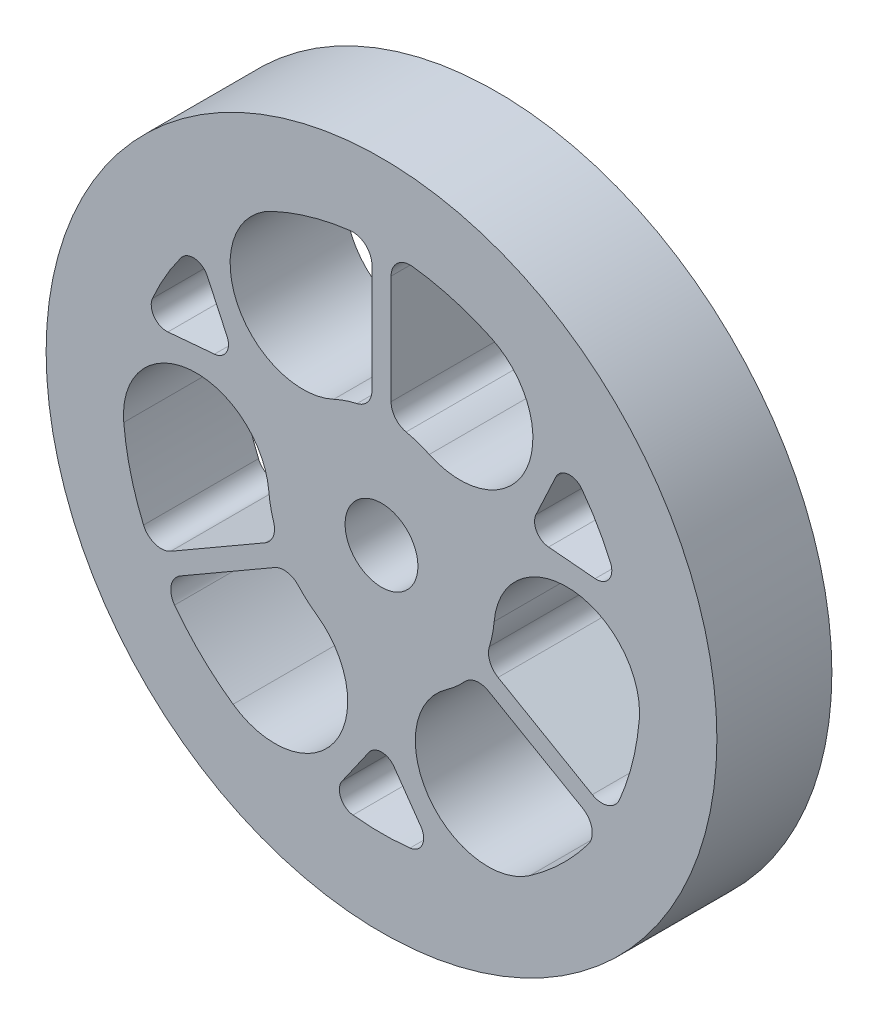
from build123d import *

# Parameters (mm, degrees)
SKETCH1_R           = 22.225
BOSS_EXTRUDE1_DEPTH = 7.62
SKETCH2_R           = 2.413
CUT_EXTRUDE1_DEPTH  = 33.341392209
EXTRUDE_THIN1_DEPTH = 7.62
FILLET1_R           = 1.27


with BuildPart() as part:
    # Sketch1 → Boss-Extrude1 (new body)
    with BuildSketch(Plane.XY):
        with Locations(Location((0, 0, 0), (0, 0, 180))):
            Circle(SKETCH1_R)
    extrude(amount=BOSS_EXTRUDE1_DEPTH)

    # Sketch2 → Cut-Extrude1 (cut, through all)
    with BuildSketch(Plane.XY.offset(7.62)):
        Circle(SKETCH2_R)
        with BuildLine():
            Line((11.546285712, 9.679232711), (10.236925711, 6.871301126))
            ThreePointArc((10.236925711, 6.871301126), (10.277852612, 5.933920972), (11.069184188, 5.429787159))
            Line((11.069184188, 5.429787159), (14.155604273, 5.159760391))
            ThreePointArc((14.155604273, 5.159760391), (15.068334078, 5.577769607), (15.176404699, 6.575831801))
            ThreePointArc((15.176404699, 6.575831801), (14.323882769, 8.269897573), (13.28303974, 9.855236107))
            ThreePointArc((13.28303974, 9.855236107), (12.364657215, 10.260675301), (11.546285712, 9.679232711))
        make_face()
        with BuildLine():
            Line((2.609318561, -14.838993102), (0.832258477, -12.301088285))
            ThreePointArc((0.832258477, -12.301088285), (0, -11.867841944), (-0.832258477, -12.301088285))
            Line((-0.832258477, -12.301088285), (-2.609318561, -14.838993102))
            ThreePointArc((-2.609318561, -14.838993102), (-2.703676863, -15.838444908), (-1.893364959, -16.431067908))
            ThreePointArc((-1.893364959, -16.431067908), (0, -16.539795145), (1.893364959, -16.431067908))
            ThreePointArc((1.893364959, -16.431067908), (2.703676863, -15.838444908), (2.609318561, -14.838993102))
        make_face()
        with BuildLine():
            Line((-14.155604273, 5.159760391), (-11.069184188, 5.429787159))
            ThreePointArc((-11.069184188, 5.429787159), (-10.277852612, 5.933920972), (-10.236925711, 6.871301126))
            Line((-10.236925711, 6.871301126), (-11.546285712, 9.679232711))
            ThreePointArc((-11.546285712, 9.679232711), (-12.364657215, 10.260675301), (-13.28303974, 9.855236107))
            ThreePointArc((-13.28303974, 9.855236107), (-14.323882769, 8.269897573), (-15.176404699, 6.575831801))
            ThreePointArc((-15.176404699, 6.575831801), (-15.068334078, 5.577769607), (-14.155604273, 5.159760391))
        make_face()
        with BuildLine():
            ThreePointArc((7.245790098, 15.538647009), (0, 17.145), (-7.245790098, 15.538647009))
            ThreePointArc((-7.245790098, 15.538647009), (-9.580075747, 9.125249897), (-3.166678635, 6.790964248))
            ThreePointArc((-3.166678635, 6.790964248), (0, 7.493), (3.166678635, 6.790964248))
            ThreePointArc((3.166678635, 6.790964248), (9.580075747, 9.125249897), (7.245790098, 15.538647009))
        make_face()
        with BuildLine():
            ThreePointArc((9.833968001, -14.044361799), (14.848005548, -8.5725), (17.079758099, -1.494285209))
            ThreePointArc((17.079758099, -1.494285209), (12.6927361, 3.733964018), (7.464486873, -0.65305798))
            ThreePointArc((7.464486873, -0.65305798), (6.489128351, -3.7465), (4.297808238, -6.137906268))
            ThreePointArc((4.297808238, -6.137906268), (3.112660354, -12.859213915), (9.833968001, -14.044361799))
        make_face()
        with BuildLine():
            ThreePointArc((-17.079758099, -1.494285209), (-14.848005548, -8.5725), (-9.833968001, -14.044361799))
            ThreePointArc((-9.833968001, -14.044361799), (-3.112660354, -12.859213915), (-4.297808238, -6.137906268))
            ThreePointArc((-4.297808238, -6.137906268), (-6.489128351, -3.7465), (-7.464486873, -0.65305798))
            ThreePointArc((-7.464486873, -0.65305798), (-12.6927361, 3.733964018), (-17.079758099, -1.494285209))
        make_face()
    extrude(amount=-CUT_EXTRUDE1_DEPTH, mode=Mode.SUBTRACT)

    # Sketch3 → Extrude-Thin1 (add)
    with BuildSketch(Plane.XY.offset(7.62)):
        Polygon((0.635, 6.223), (0.635, 7.493), (0.635, 17.145), (-0.635, 17.145), (-0.635, 7.493), (-0.635, 6.223), align=None)
        Polygon((5.071776088, -3.661426131), (6.171628351, -4.296426131), (14.530505548, -9.122426131), (15.165505548, -8.022573869), (6.806628351, -3.196573869), (5.706776088, -2.561573869), align=None)
        Polygon((-5.706776088, -2.561573869), (-6.806628351, -3.196573869), (-15.165505548, -8.022573869), (-14.530505548, -9.122426131), (-6.171628351, -4.296426131), (-5.071776088, -3.661426131), align=None)
    extrude(amount=-EXTRUDE_THIN1_DEPTH)

    # Fillet1
    fillet1_edges = [part.edges().sort_by_distance(p)[0] for p in [
        (-0.635, 17.133236705, 3.81),
        (0.635, 17.133236705, 3.81),
        (0.635, 7.466044736, 3.81),
        (-0.635, 7.466044736, 3.81),
        (15.155318236, -8.016692221, 3.81),
        (14.520318236, -9.116544484, 3.81),
        (6.148284407, -4.282948499, 3.81),
        (6.783284407, -3.183096237, 3.81),
        (-14.520318236, -9.116544484, 3.81),
        (-15.155318236, -8.016692221, 3.81),
        (-6.783284407, -3.183096237, 3.81),
        (-6.148284407, -4.282948499, 3.81),
    ]]
    fillet(fillet1_edges, radius=FILLET1_R)


solid = part.part
